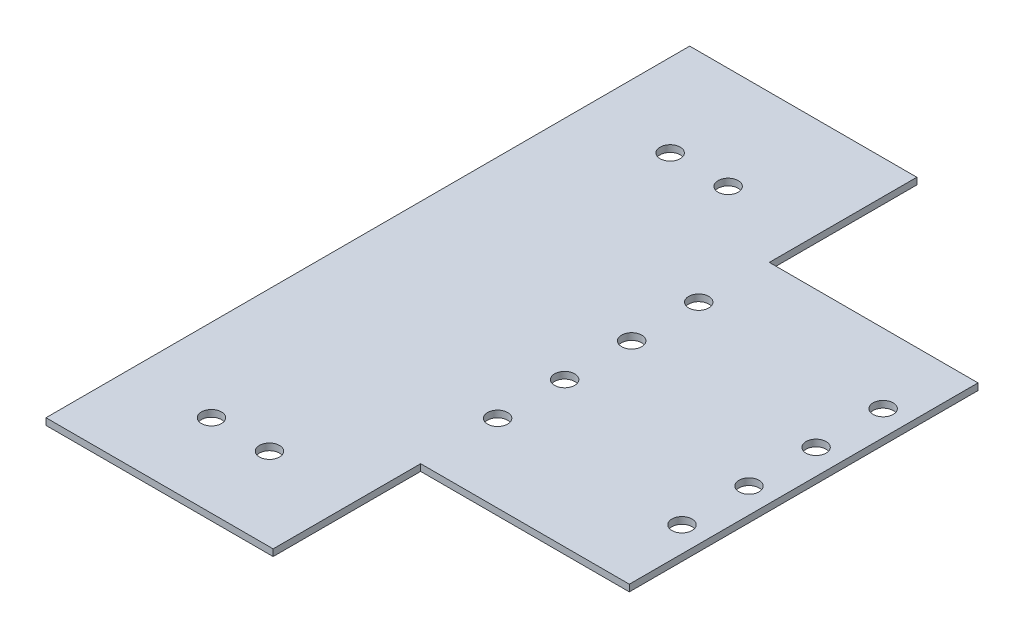
from build123d import *

# Parameters (mm, degrees)
SKETCH_1_W          = 17.893001423
SKETCH_1_H          = 11.620982588
SKETCH_1_H_2        = 11.620982589
EXTRUDE_1_DEPTH     = 1
SKETCH_2_R          = 1.5
CUT_EXTRUDE_1_DEPTH = 10
SKETCH_3_R          = 1.5
CUT_EXTRUDE_2_DEPTH = 10
SKETCH_4_W          = 33.892879225
SKETCH_4_H          = 96
CUT_EXTRUDE_3_DEPTH = 10


with BuildPart() as part:
    # Эскиз1 → Бобышка-Вытянуть1 (new body)
    with BuildSketch(Plane(origin=(0, 0, 0), x_dir=(1, 0, 0), z_dir=(0, 1, 0))):
        Polygon((49.933797981, 26), (18.809932441, 26), (18.809932441, 48), (15, 48), (-48.959081244, 48), (-48.959081244, -48), (15, -48), (18.809932441, -48), (18.809932441, -26), (49.933797981, -26), align=None)
        with Locations((-36.319088007, -31.12001489)):
            Rectangle(SKETCH_1_W, SKETCH_1_H, mode=Mode.SUBTRACT)
        with Locations((-36.319088007, 31.12001489)):
            Rectangle(SKETCH_1_W, SKETCH_1_H_2, mode=Mode.SUBTRACT)
    extrude(amount=EXTRUDE_1_DEPTH)

    # Эскиз2 → Вырез-Вытянуть1 (cut)
    with BuildSketch(Plane(origin=(0, 1, 0), x_dir=(1, 0, 0), z_dir=(0, 1, 0))):
        with Locations(Location((46.183797981, -14.4, 0), (0, 0, 270))):
            Circle(SKETCH_2_R)
        with Locations(Location((18.683797981, -14.4, 0), (0, 0, 270))):
            Circle(SKETCH_2_R)
        with Locations(Location((18.683797981, -4.4, 0), (0, 0, 270))):
            Circle(SKETCH_2_R)
        with Locations(Location((46.183797981, -4.4, 0), (0, 0, 270))):
            Circle(SKETCH_2_R)
        with Locations(Location((18.683797981, 5.6, 0), (0, 0, 270))):
            Circle(SKETCH_2_R)
        with Locations(Location((46.183797981, 5.6, 0), (0, 0, 270))):
            Circle(SKETCH_2_R)
        with Locations(Location((18.683797981, 15.6, 0), (0, 0, 270))):
            Circle(SKETCH_2_R)
        with Locations(Location((46.183797981, 15.6, 0), (0, 0, 270))):
            Circle(SKETCH_2_R)
    extrude(amount=-CUT_EXTRUDE_1_DEPTH, mode=Mode.SUBTRACT)

    # Эскиз3 → Вырез-Вытянуть2 (cut)
    with BuildSketch(Plane(origin=(0, 1, 0), x_dir=(1, 0, 0), z_dir=(0, 1, 0))):
        with Locations(Location((5.923569009, 32.746976788, 0), (0, 0, 270))):
            Circle(SKETCH_3_R)
        with Locations(Location((-2.726430991, 32.746976788, 0), (0, 0, 270))):
            Circle(SKETCH_3_R)
        with Locations(Location((-2.726430991, -35.660220789, 0), (0, 0, 270))):
            Circle(SKETCH_3_R)
        with Locations(Location((5.923569009, -35.660220789, 0), (0, 0, 270))):
            Circle(SKETCH_3_R)
    extrude(amount=-CUT_EXTRUDE_2_DEPTH, mode=Mode.SUBTRACT)

    # Эскиз4 → Вырез-Вытянуть3 (cut)
    with BuildSketch(Plane.XZ):
        with Locations((-32.012641632, 0)):
            Rectangle(SKETCH_4_W, SKETCH_4_H)
    extrude(amount=-CUT_EXTRUDE_3_DEPTH, mode=Mode.SUBTRACT)


solid = part.part
